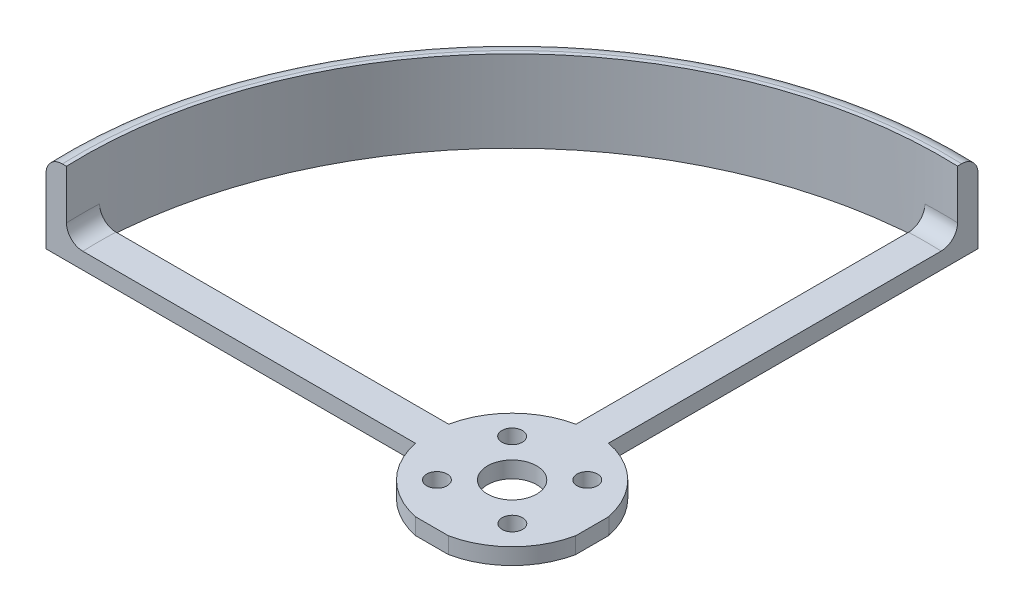
from build123d import *

# Parameters (mm, degrees)
SKETCH1_R           = 69.85
BOSS_EXTRUDE1_DEPTH = 12.7
CUT_EXTRUDE12_START = -10.16
CUT_EXTRUDE12_DEPTH = 10.16
SKETCH16_W          = 69.932780821
SKETCH16_H          = 69.651198358
BOSS_EXTRUDE5_DEPTH = 2.54
CUT_EXTRUDE13_DEPTH = 100.362175566
SKETCH19_R          = 3.81
SKETCH19_R_2        = 1.5875
CUT_EXTRUDE14_DEPTH = 100.362175566
FILLET27_R          = 2.54
FILLET28_R          = 2.54
FILLET31_R          = 2.54
CUT_EXTRUDE15_DEPTH = 100.362175647
CUT_EXTRUDE16_DEPTH = 100.595858501


with BuildPart() as part:
    # Sketch1 → Boss-Extrude1 (new body)
    with BuildSketch(Plane(origin=(0, 0, 0), x_dir=(1, 0, 0), z_dir=(0, 1, 0))):
        with Locations(Location((0, 0, 0), (0, 0, 270))):
            Circle(SKETCH1_R)
    extrude(amount=BOSS_EXTRUDE1_DEPTH)

    # Sketch15 → Cut-Extrude12 (cut)
    with BuildSketch(Plane(origin=(0, 12.7, 0), x_dir=(1, 0, 0), z_dir=(0, 1, 0)).offset(CUT_EXTRUDE12_START)):
        with BuildLine():
            Line((2.535588172, -66.626769527), (2.656330466, -69.799472838))
            ThreePointArc((2.656330466, -69.799472838), (49.392766771, -49.390050523), (69.799618816, -2.652491886))
            Line((69.799618816, -2.652491886), (66.626908869, -2.531924073))
            ThreePointArc((66.626908869, -2.531924073), (-47.147641009, 47.145048227), (2.535588172, -66.626769527))
        make_face()
    extrude(amount=CUT_EXTRUDE12_DEPTH, mode=Mode.SUBTRACT)

    # Sketch16 → Boss-Extrude5 (add)
    with BuildSketch(Plane(origin=(0, 2.54, 0), x_dir=(1, 0, 0), z_dir=(0, 1, 0))):
        with Locations((34.966390411, -34.825599179)):
            Rectangle(SKETCH16_W, SKETCH16_H)
    extrude(amount=-BOSS_EXTRUDE5_DEPTH)

    # Sketch18 → Cut-Extrude13 (cut, through all)
    with BuildSketch(Plane(origin=(0, 2.54, 0), x_dir=(1, 0, 0), z_dir=(0, 1, 0))):
        with BuildLine():
            Line((-2.535588172, -66.626769527), (-2.535588172, -12.444307639))
            ThreePointArc((-2.535588172, -12.444307639), (-8.966889105, -8.99360327), (-12.436709804, -2.572595822))
            Line((-12.436709804, -2.572595822), (-66.625350849, -2.572595822))
            ThreePointArc((-66.625350849, -2.572595822), (-47.133249027, -47.159436608), (-2.535588172, -66.626769527))
        make_face()
        with BuildLine():
            ThreePointArc((-12.436709804, 2.572595822), (-8.966889105, 8.99360327), (-2.535588172, 12.444307639))
            Line((-2.535588172, 12.444307639), (-2.535588172, 66.626769527))
            ThreePointArc((-2.535588172, 66.626769527), (-47.133249027, 47.159436608), (-66.625350849, 2.572595822))
            Line((-66.625350849, 2.572595822), (-12.436709804, 2.572595822))
        make_face()
        with BuildLine():
            Line((2.535588172, 66.626769527), (2.535588172, 12.444307639))
            ThreePointArc((2.535588172, 12.444307639), (8.966889105, 8.99360327), (12.436709804, 2.572595822))
            Line((12.436709804, 2.572595822), (66.625350849, 2.572595822))
            ThreePointArc((66.625350849, 2.572595822), (47.133249027, 47.159436608), (2.535588172, 66.626769527))
        make_face()
        with BuildLine():
            ThreePointArc((12.436709804, -2.572595822), (8.966889105, -8.99360327), (2.535588172, -12.444307639))
            Line((2.535588172, -12.444307639), (2.535588172, -66.626769527))
            ThreePointArc((2.535588172, -66.626769527), (47.133249027, -47.159436608), (66.625350849, -2.572595822))
            Line((66.625350849, -2.572595822), (12.436709804, -2.572595822))
        make_face()
    extrude(amount=-CUT_EXTRUDE13_DEPTH, mode=Mode.SUBTRACT)

    # Sketch19 → Cut-Extrude14 (cut, through all)
    with BuildSketch(Plane(origin=(0, 2.54, 0), x_dir=(1, 0, 0), z_dir=(0, 1, 0))):
        with Locations(Location((0, 0, 0), (0, 0, 270))):
            Circle(SKETCH19_R)
        with Locations(Location((5.828477918, 5.845842126, 0), (0, 0, 270))):
            Circle(SKETCH19_R_2)
        with Locations(Location((-5.845842126, -5.828477918, 0), (0, 0, 90))):
            Circle(SKETCH19_R_2)
        with Locations(Location((-5.864478401, 5.864478401, 0), (0, 0, 270))):
            Circle(SKETCH19_R_2)
        with Locations(Location((5.881897888, -5.847007018, 0), (0, 0, 90))):
            Circle(SKETCH19_R_2)
    extrude(amount=-CUT_EXTRUDE14_DEPTH, mode=Mode.SUBTRACT)

    # Fillet27
    fillet27_edges = [part.edges().sort_by_distance(p)[0] for p in [
        (-66.675, 2.54, 0),
    ]]
    fillet(fillet27_edges, radius=FILLET27_R)

    # Fillet28
    fillet28_edges = [part.edges().sort_by_distance(p)[0] for p in [
        (0, 2.54, -66.675),
    ]]
    fillet(fillet28_edges, radius=FILLET28_R)

    # Fillet31
    fillet31_edges = [part.edges().sort_by_distance(p)[0] for p in [
        (-49.392766771, 12.7, -49.390050523),
    ]]
    fillet(fillet31_edges, radius=FILLET31_R)

    # Sketch20 → Cut-Extrude15 (cut, through all)
    with BuildSketch(Plane(origin=(0, 2.54, 0), x_dir=(1, 0, 0), z_dir=(0, 1, 0))):
        with BuildLine():
            Line((-2.535588172, -12.444307639), (2.535588172, -12.444307639))
            Line((2.535588172, -12.444307639), (2.535588172, -66.626769527))
            ThreePointArc((2.535588172, -66.626769527), (0, -66.675), (-2.535588172, -66.626769527))
            Line((-2.535588172, -66.626769527), (-2.535588172, -12.444307639))
        make_face()
        with BuildLine():
            Line((12.436709804, -2.572595822), (12.436709804, 2.572595822))
            Line((12.436709804, 2.572595822), (66.625350849, 2.572595822))
            ThreePointArc((66.625350849, 2.572595822), (66.674996894, 0.02035079), (66.626908869, -2.531924073))
            Line((66.626908869, -2.531924073), (69.799618816, -2.652491886))
            ThreePointArc((69.799618816, -2.652491886), (69.837403568, -1.326485155), (69.85, 0))
            Line((69.85, 0), (69.932780821, 0))
            Line((69.932780821, 0), (69.932780821, -69.651198358))
            Line((69.932780821, -69.651198358), (5.266219444, -69.651198358))
            ThreePointArc((5.266219444, -69.651198358), (3.961968652, -69.737545873), (2.656330466, -69.799472838))
            Line((2.656330466, -69.799472838), (2.535588172, -66.626769527))
            ThreePointArc((2.535588172, -66.626769527), (47.133249027, -47.159436608), (66.625350849, -2.572595822))
            Line((66.625350849, -2.572595822), (12.436709804, -2.572595822))
        make_face()
    extrude(amount=-CUT_EXTRUDE15_DEPTH, mode=Mode.SUBTRACT)

    # Sketch21 → Cut-Extrude16 (cut, through all)
    with BuildSketch(Plane.XZ):
        with BuildLine():
            Line((-12.436709804, 2.572595822), (-72.625686252, 2.572595822))
            Line((-72.625686252, 2.572595822), (-72.625686252, 86.482314908))
            Line((-72.625686252, 86.482314908), (90.769446287, 86.482314908))
            Line((90.769446287, 86.482314908), (90.769446287, -81.729929128))
            Line((90.769446287, -81.729929128), (2.535588172, -81.729929128))
            Line((2.535588172, -81.729929128), (2.535588172, -12.444307639))
            ThreePointArc((2.535588172, -12.444307639), (8.966889105, -8.99360327), (12.436709804, -2.572595822))
            Line((12.436709804, -2.572595822), (12.436709804, 2.572595822))
            ThreePointArc((12.436709804, 2.572595822), (8.966889105, 8.99360327), (2.535588172, 12.444307639))
            Line((2.535588172, 12.444307639), (-2.535588172, 12.444307639))
            ThreePointArc((-2.535588172, 12.444307639), (-8.966889105, 8.99360327), (-12.436709804, 2.572595822))
        make_face()
    extrude(amount=-CUT_EXTRUDE16_DEPTH, mode=Mode.SUBTRACT)


solid = part.part
